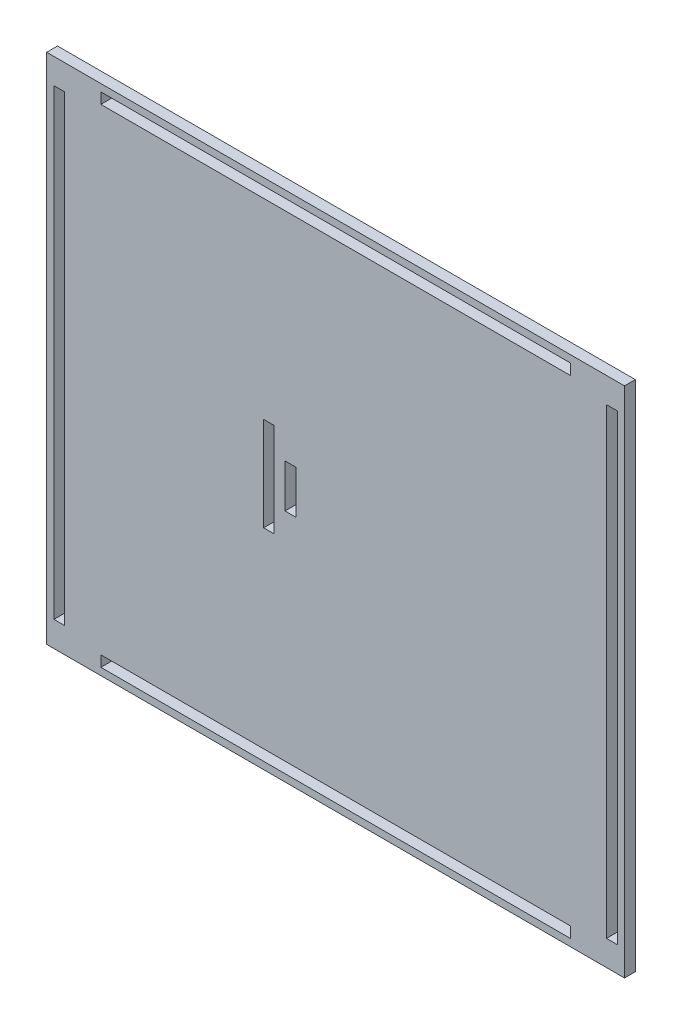
from build123d import *

# Parameters (mm, degrees)
SKETCH1_W           = 160
SKETCH1_H           = 142
SKETCH1_W_2         = 130
SKETCH1_H_2         = 3
SKETCH1_W_3         = 3
SKETCH1_H_3         = 128
SKETCH1_W_4         = 2.919660042
SKETCH1_H_4         = 26
SKETCH1_H_5         = 12
BOSS_EXTRUDE1_DEPTH = 3


with BuildPart() as part:
    # Sketch1 → Boss-Extrude1 (new body)
    with BuildSketch(Plane.XY):
        with Locations((1.774525815, -31.886752246)):
            Rectangle(SKETCH1_W, SKETCH1_H)
        with Locations((1.774525815, 35.613247754)):
            Rectangle(SKETCH1_W_2, SKETCH1_H_2, mode=Mode.SUBTRACT)
        with Locations((1.774525815, -99.386752246)):
            Rectangle(SKETCH1_W_2, SKETCH1_H_2, mode=Mode.SUBTRACT)
        with Locations((-74.725474185, -31.886752246)):
            Rectangle(SKETCH1_W_3, SKETCH1_H_3, mode=Mode.SUBTRACT)
        with Locations((78.274525815, -31.886752246)):
            Rectangle(SKETCH1_W_3, SKETCH1_H_3, mode=Mode.SUBTRACT)
        with Locations((-16.685304206, -31.886752246)):
            Rectangle(SKETCH1_W_4, SKETCH1_H_4, mode=Mode.SUBTRACT)
        with Locations((-10.725474185, -31.886752246)):
            Rectangle(SKETCH1_W_3, SKETCH1_H_5, mode=Mode.SUBTRACT)
    extrude(amount=BOSS_EXTRUDE1_DEPTH)


solid = part.part
